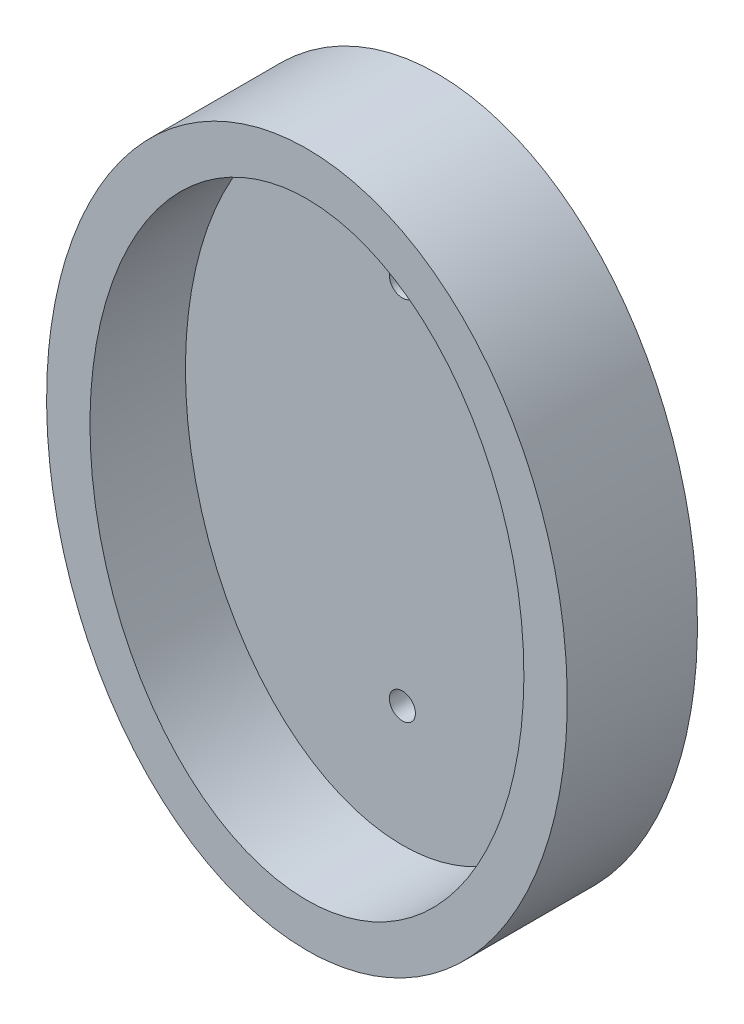
from build123d import *

# Parameters (mm, degrees)
SKETCH_1_RX         = 35
SKETCH_1_RY         = 25
EXTRUDE_1_DEPTH     = 4
SKETCH_4_W          = 3.5
SKETCH_4_H          = 16
EXTRUDE_3_DEPTH     = 15
SKETCH_5_R          = 1.75
CUT_EXTRUDE_2_DEPTH = 15
SKETCH_8_R          = 1.5
CUT_EXTRUDE_3_DEPTH = 46.552167896
SKETCH_9_RX         = 35
SKETCH_9_RY         = 25
EXTRUDE_4_DEPTH     = 15


with BuildPart() as part:
    # 草图1 → 凸台-拉伸1 (new body)
    with BuildSketch(Plane.XY):
        with Locations(Location((0, 0), (0, 0, 90))):
            Ellipse(SKETCH_1_RX, SKETCH_1_RY)
    extrude(amount=EXTRUDE_1_DEPTH)

    # 草图4 → 凸台-拉伸3 (add)
    with BuildSketch(Plane(origin=(0, 0, 0), x_dir=(-1, 0, 0), z_dir=(0, 0, -1))):
        with Locations((-4.25, 0)):
            Rectangle(SKETCH_4_W, SKETCH_4_H)
        with Locations((4.25, 0)):
            Rectangle(SKETCH_4_W, SKETCH_4_H)
    extrude(amount=EXTRUDE_3_DEPTH)

    # 草图5 → 切除-拉伸2 (cut)
    with BuildSketch(Plane(origin=(6, 0, 0), x_dir=(0, 0, -1), z_dir=(1, 0, 0))):
        with Locations(Location((8.2, 4, 0), (0, 0, 270))):
            Circle(SKETCH_5_R)
        with Locations(Location((8.2, -4, 0), (0, 0, 270))):
            Circle(SKETCH_5_R)
    extrude(amount=-CUT_EXTRUDE_2_DEPTH, mode=Mode.SUBTRACT)

    # 草图8 → 切除-拉伸3 (cut, through all)
    with BuildSketch(Plane(origin=(0, 0, 0), x_dir=(-1, 0, 0), z_dir=(0, 0, -1))):
        with Locations((0, 21.1)):
            Circle(SKETCH_8_R)
        with Locations(Location((0, -21.1, 0), (0, 0, 180))):
            Circle(SKETCH_8_R)
    extrude(amount=-CUT_EXTRUDE_3_DEPTH, mode=Mode.SUBTRACT)

    # 草图9 → 凸台-拉伸4 (add)
    with BuildSketch(Plane(origin=(0, 0, 0), x_dir=(-1, 0, 0), z_dir=(0, 0, -1))):
        with BuildLine():
            add(Edge.make_bspline(
                [(0, -40), (1.166191286, -40), (2.319723365, -39.911088785), (4.03183367, -39.649980915), (4.599496891, -39.541592189), (5.728776608, -39.282345915), (6.29227568, -39.130877572), (9.070055488, -38.274724151), (11.150296457, -37.285955015), (13.595631547, -35.718362777), (14.075904728, -35.388485686), (15.010083742, -34.704290506), (15.465429587, -34.349070294), (16.798122828, -33.24615002), (17.642230421, -32.461307082), (18.847120419, -31.215576692), (19.238510272, -30.788890668), (20.001389667, -29.913281582), (20.371832338, -29.465458404), (21.444101113, -28.103190972), (22.110352352, -27.166221001), (23.978053386, -24.277664054), (25.049598622, -22.249110294), (26.426239112, -19.069606275), (26.846424907, -17.985354188), (27.599952299, -15.808111676), (27.935335111, -14.710762561), (28.825344872, -11.394219795), (29.264692044, -9.150711882), (29.705830252, -5.739495258), (29.816333167, -4.594715542), (29.926955174, -2.86591771), (29.954635547, -2.286827379), (29.991228174, -1.131937385), (30.000207168, -0.55555325), (29.999153206, 2.321135714), (29.852315206, 4.60586403), (29.265935478, 9.14199365), (28.826617088, 11.393420383), (28.076211879, 14.184788813), (27.915776755, 14.742452866), (27.576462348, 15.84713034), (27.397347547, 16.395104713), (26.831272972, 18.025769818), (26.415651344, 19.095234066), (25.048915834, 22.248310531), (23.979614833, 24.277383351), (22.408026895, 26.705297428), (22.080994544, 27.186502009), (21.40757458, 28.12910054), (21.060913216, 28.591040915), (19.99027861, 29.948036415), (19.23575735, 30.814362309), (17.638758672, 32.464294729), (16.796330807, 33.247947857), (15.459060394, 34.354182681), (14.999460278, 34.712447006), (14.062064887, 35.398236233), (13.585014896, 35.725377845), (12.12829731, 36.658580422), (11.12315733, 37.216598724), (9.560891384, 37.95072988), (9.031021276, 38.178249144), (7.95213771, 38.597182003), (7.400833463, 38.789269626), (4.623285017, 39.64502), (2.357345431, 39.995300066), (-0.531810914, 40.001117073), (-1.114724671, 39.98021092), (-2.275863899, 39.89394367), (-2.851380333, 39.828976316), (-4.563305894, 39.570888155), (-5.685140717, 39.314794846), (-7.339848067, 38.809478842), (-7.886730074, 38.620788161), (-8.97116282, 38.203088351), (-9.508549043, 37.973934798), (-11.083858371, 37.237666373), (-12.093235434, 36.678985185), (-14.03733934, 35.437595254), (-14.973473094, 34.75362982), (-16.768841411, 33.272852191), (-17.61469289, 32.487502562), (-20.015069091, 30.01246223), (-21.433744651, 28.204932951), (-23.010856074, 25.775304476), (-23.31654898, 25.280301057), (-23.903032252, 24.283070837), (-24.184598133, 23.77970285), (-24.996071241, 22.256074098), (-25.492845708, 21.222325901), (-26.861021423, 18.07135836), (-27.611238428, 15.904808256), (-28.513163822, 12.564043083), (-28.776674196, 11.432267539), (-29.22403894, 9.168039209), (-29.408897937, 8.032604647), (-29.851790115, 4.616749038), (-29.998952192, 2.326845662), (-30.000515604, -1.126754901), (-29.964134461, -2.283503276), (-29.816548228, -4.592727237), (-29.705920354, -5.73874514), (-29.264633227, -9.151273442), (-28.825462565, -11.392466572), (-27.642377976, -15.803751855), (-26.898978714, -17.973964087), (-25.518747178, -21.167423186), (-25.018171104, -22.211625387), (-23.938295744, -24.244992269), (-23.358161566, -25.236163641), (-22.111952325, -27.16396109), (-21.445913863, -28.100610398), (-20.375836401, -29.460509257), (-20.00727873, -29.906278236), (-19.2449084, -30.781787259), (-18.851246908, -31.211186626), (-16.839262141, -33.291984661), (-15.075502325, -34.76698967), (-12.642550882, -36.329993624), (-12.143438156, -36.62890334), (-11.124669307, -37.194004781), (-10.608616319, -37.458273109), (-9.040230981, -38.195625903), (-7.967745905, -38.613460088), (-6.316585337, -39.123878092), (-5.759108975, -39.274580989), (-4.629385194, -39.535490772), (-4.055227442, -39.64593791), (-2.327465641, -39.910836495), (-1.166191286, -40), (0, -40)],
                knots=[0, 0, 0, 0, 0.015625, 0.015625, 0.0234375, 0.0234375, 0.03125, 0.03125, 0.0625, 0.0625, 0.0703125, 0.0703125, 0.078125, 0.078125, 0.09375, 0.09375, 0.1015625, 0.1015625, 0.109375, 0.109375, 0.125, 0.125, 0.15625, 0.15625, 0.171875, 0.171875, 0.1875, 0.1875, 0.21875, 0.21875, 0.234375, 0.234375, 0.2421875, 0.2421875, 0.25, 0.25, 0.28125, 0.28125, 0.3125, 0.3125, 0.3203125, 0.3203125, 0.328125, 0.328125, 0.34375, 0.34375, 0.375, 0.375, 0.3828125, 0.3828125, 0.390625, 0.390625, 0.40625, 0.40625, 0.421875, 0.421875, 0.4296875, 0.4296875, 0.4375, 0.4375, 0.453125, 0.453125, 0.4609375, 0.4609375, 0.46875, 0.46875, 0.5, 0.5, 0.5078125, 0.5078125, 0.515625, 0.515625, 0.53125, 0.53125, 0.5390625, 0.5390625, 0.546875, 0.546875, 0.5625, 0.5625, 0.578125, 0.578125, 0.59375, 0.59375, 0.625, 0.625, 0.6328125, 0.6328125, 0.640625, 0.640625, 0.65625, 0.65625, 0.6875, 0.6875, 0.703125, 0.703125, 0.71875, 0.71875, 0.75, 0.75, 0.765625, 0.765625, 0.78125, 0.78125, 0.8125, 0.8125, 0.84375, 0.84375, 0.859375, 0.859375, 0.875, 0.875, 0.890625, 0.890625, 0.8984375, 0.8984375, 0.90625, 0.90625, 0.9375, 0.9375, 0.9453125, 0.9453125, 0.953125, 0.953125, 0.96875, 0.96875, 0.9765625, 0.9765625, 0.984375, 0.984375, 1, 1, 1, 1], degree=3))
        make_face()
        with Locations(Location((0, 0), (0, 0, 90))):
            Ellipse(SKETCH_9_RX, SKETCH_9_RY, mode=Mode.SUBTRACT)
    extrude(amount=-EXTRUDE_4_DEPTH)


solid = part.part
